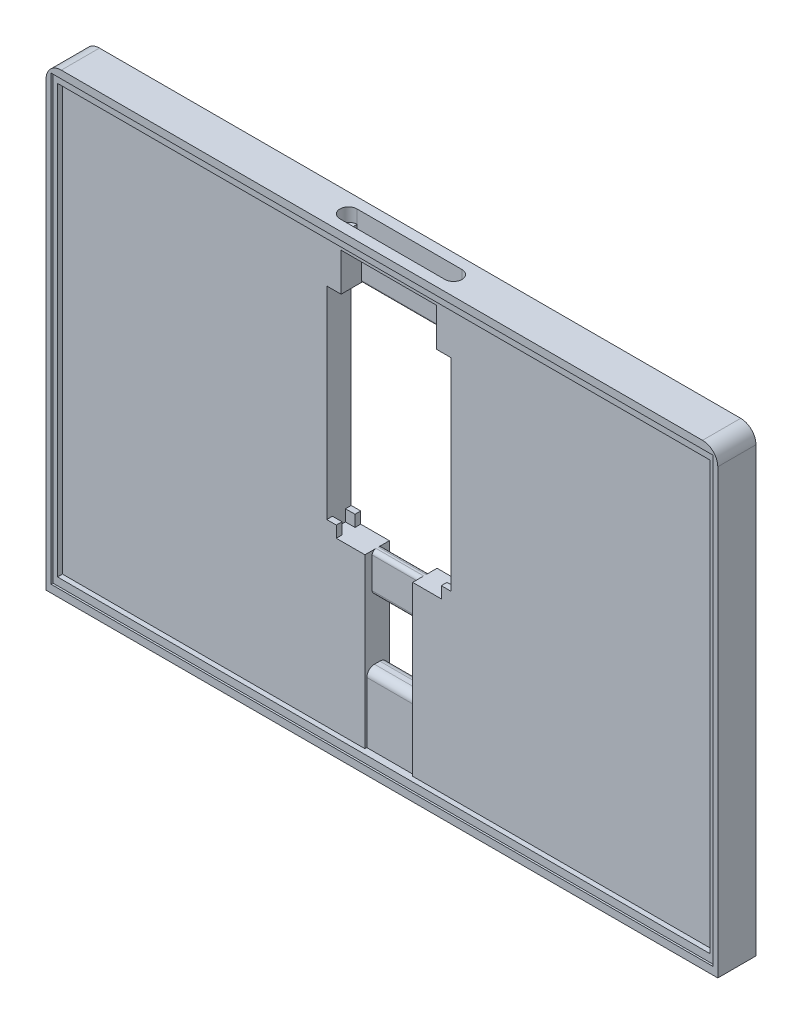
from build123d import *

# Parameters (mm, degrees)
SKETCH_1_W           = 176
SKETCH_1_H           = 120
EXTRUDE_1_DEPTH      = 10
SKETCH_2_W           = 171
SKETCH_2_H           = 112
CUT_EXTRUDE_1_DEPTH  = 1.8
SKETCH_3_W           = 171
SKETCH_3_H           = 112
CUT_EXTRUDE_2_DEPTH  = 1.8
SKETCH_5_W           = 173.4
SKETCH_5_H           = 116
CUT_EXTRUDE_3_DEPTH  = 0.5
SKETCH_6_W           = 173.4
SKETCH_6_H           = 116
CUT_EXTRUDE_4_DEPTH  = 0.5
SKETCH_7_W           = 32.5
SKETCH_7_H           = 56
CUT_EXTRUDE_5_DEPTH  = 107.823405675
SKETCH_8_W           = 12.5
SKETCH_8_H           = 44
CUT_EXTRUDE_6_DEPTH  = 0.5
SKETCH_9_W           = 12.5
SKETCH_9_H           = 44
CUT_EXTRUDE_7_DEPTH  = 0.5
SKETCH_10_W          = 25
SKETCH_10_H          = 12
CUT_EXTRUDE_8_DEPTH  = 0.8
CUT_EXTRUDE_10_DEPTH = 6
FILLET_1_R           = 4
FILLET_2_R           = 4
SKETCH_18_W          = 1.5
SKETCH_18_H          = 3
EXTRUDE_3_DEPTH      = 2.5
SKETCH_20_W          = 1.5
SKETCH_20_H          = 3
EXTRUDE_4_DEPTH      = 2.5
SKETCH_21_W          = 12.5
SKETCH_21_H          = 16
CUT_EXTRUDE_12_DEPTH = 107.786188245
SKETCH_22_W          = 25
SKETCH_22_H          = 10
CUT_EXTRUDE_13_DEPTH = 4.5
SKETCH_23_W          = 25
SKETCH_23_H          = 2
EXTRUDE_5_DEPTH      = 0.8
FILLET_15_R          = 0.5
EXTRUDE_START        = 2.5
EXTRUDE_6_DEPTH      = 2.5
SKETCH_25_W          = 12.5
SKETCH_25_H          = 10.082968054
CUT_EXTRUDE_14_DEPTH = 1.4
SKETCH_26_W          = 12.5
SKETCH_26_H          = 10.082968054
CUT_EXTRUDE_15_DEPTH = 1.4
FILLET_16_R          = 1
FILLET_17_R          = 1
FILLET_18_R          = 1
FILLET_19_R          = 1
FILLET_21_R          = 2
FILLET_22_R          = 2
SKETCH_28_R          = 2.75
CUT_EXTRUDE_16_DEPTH = 5.5
FILLET_23_R          = 0.5


with BuildPart() as part:
    # 草图1 → 凸台-拉伸1 (new body)
    with BuildSketch(Plane.XY):
        Rectangle(SKETCH_1_W, SKETCH_1_H)
    extrude(amount=EXTRUDE_1_DEPTH)

    # 草图2 → 切除-拉伸1 (cut)
    with BuildSketch(Plane.XY.offset(10)):
        Rectangle(SKETCH_2_W, SKETCH_2_H)
    extrude(amount=-CUT_EXTRUDE_1_DEPTH, mode=Mode.SUBTRACT)

    # 草图3 → 切除-拉伸2 (cut)
    with BuildSketch(Plane(origin=(0, 0, 0), x_dir=(-1, 0, 0), z_dir=(0, 0, -1))):
        Rectangle(SKETCH_3_W, SKETCH_3_H)
    extrude(amount=-CUT_EXTRUDE_2_DEPTH, mode=Mode.SUBTRACT)

    # 草图5 → 切除-拉伸3 (cut)
    with BuildSketch(Plane(origin=(0, 0, 0), x_dir=(-1, 0, 0), z_dir=(0, 0, -1))):
        Rectangle(SKETCH_5_W, SKETCH_5_H)
    extrude(amount=-CUT_EXTRUDE_3_DEPTH, mode=Mode.SUBTRACT)

    # 草图6 → 切除-拉伸4 (cut)
    with BuildSketch(Plane.XY.offset(10)):
        Rectangle(SKETCH_6_W, SKETCH_6_H)
    extrude(amount=-CUT_EXTRUDE_4_DEPTH, mode=Mode.SUBTRACT)

    # 草图7 → 切除-拉伸5 (cut, through all)
    with BuildSketch(Plane(origin=(0, 0, 1.8), x_dir=(-1, 0, 0), z_dir=(0, 0, -1))):
        with Locations((0, 16)):
            Rectangle(SKETCH_7_W, SKETCH_7_H)
    extrude(amount=-CUT_EXTRUDE_5_DEPTH, mode=Mode.SUBTRACT)

    # 草图8 → 切除-拉伸6 (cut)
    with BuildSketch(Plane(origin=(0, 0, 1.8), x_dir=(-1, 0, 0), z_dir=(0, 0, -1))):
        with Locations((0, -34)):
            Rectangle(SKETCH_8_W, SKETCH_8_H)
    extrude(amount=-CUT_EXTRUDE_6_DEPTH, mode=Mode.SUBTRACT)

    # 草图9 → 切除-拉伸7 (cut)
    with BuildSketch(Plane.XY.offset(8.2)):
        with Locations((0, -34)):
            Rectangle(SKETCH_9_W, SKETCH_9_H)
    extrude(amount=-CUT_EXTRUDE_7_DEPTH, mode=Mode.SUBTRACT)

    # 草图10 → 切除-拉伸8 (cut)
    with BuildSketch(Plane.XY.offset(8.2)):
        with Locations((0, 50)):
            Rectangle(SKETCH_10_W, SKETCH_10_H)
    extrude(amount=-CUT_EXTRUDE_8_DEPTH, mode=Mode.SUBTRACT)

    # 草图13 → 切除-拉伸10 (cut)
    with BuildSketch(Plane(origin=(0, 60, 0), x_dir=(1, 0, 0), z_dir=(0, 1, 0))):
        with BuildLine():
            Line((-13.75, -2.75), (13.75, -2.75))
            ThreePointArc((13.75, -2.75), (16, -5), (13.75, -7.25))
            Line((13.75, -7.25), (-13.75, -7.25))
            ThreePointArc((-13.75, -7.25), (-16, -5), (-13.75, -2.75))
        make_face()
    extrude(amount=-CUT_EXTRUDE_10_DEPTH, mode=Mode.SUBTRACT)

    # 圆角1
    fillet_1_edges = [part.edges().sort_by_distance(p)[0] for p in [
        (-88, 60, 5),
    ]]
    fillet(fillet_1_edges, radius=FILLET_1_R)

    # 圆角2
    fillet_2_edges = [part.edges().sort_by_distance(p)[0] for p in [
        (88, 60, 5),
    ]]
    fillet(fillet_2_edges, radius=FILLET_2_R)

    # 草图18 → 凸台-拉伸3 (add)
    with BuildSketch(Plane(origin=(-16.25, 0, 0), x_dir=(0, 0, -1), z_dir=(1, 0, 0))):
        with Locations((-2.55, -10.5)):
            Rectangle(SKETCH_18_W, SKETCH_18_H)
        with Locations((-7.45, -10.5)):
            Rectangle(SKETCH_18_W, SKETCH_18_H)
    extrude(amount=EXTRUDE_3_DEPTH)

    # 草图20 → 凸台-拉伸4 (add)
    with BuildSketch(Plane.ZY.offset(-16.25)):
        with Locations((7.45, -10.5)):
            Rectangle(SKETCH_20_W, SKETCH_20_H)
        with Locations((2.55, -10.5)):
            Rectangle(SKETCH_20_W, SKETCH_20_H)
    extrude(amount=EXTRUDE_4_DEPTH)

    # 草图21 → 切除-拉伸12 (cut, through all)
    with BuildSketch(Plane(origin=(0, 0, 2.3), x_dir=(-1, 0, 0), z_dir=(0, 0, -1))):
        with Locations((0, -30.082968054)):
            Rectangle(SKETCH_21_W, SKETCH_21_H)
    extrude(amount=-CUT_EXTRUDE_12_DEPTH, mode=Mode.SUBTRACT)

    # 草图22 → 切除-拉伸13 (cut)
    with BuildSketch(Plane.XY.offset(7.4)):
        with Locations((0, 49)):
            Rectangle(SKETCH_22_W, SKETCH_22_H)
    extrude(amount=-CUT_EXTRUDE_13_DEPTH, mode=Mode.SUBTRACT)

    # 草图23 → 凸台-拉伸5 (add)
    with BuildSketch(Plane.XY.offset(7.4)):
        with Locations((0, 55)):
            Rectangle(SKETCH_23_W, SKETCH_23_H)
    extrude(amount=EXTRUDE_5_DEPTH)

    # 圆角15
    fillet_15_edges = [part.edges().sort_by_distance(p)[0] for p in [
        (0, 54, 7.25),
    ]]
    fillet(fillet_15_edges, radius=FILLET_15_R)

    # 草图24 → 凸台-拉伸6 (add)
    with BuildSketch(Plane(origin=(0, 54, 0), x_dir=(1, 0, 0), z_dir=(0, 1, 0)).offset(EXTRUDE_START)):
        with BuildLine():
            Line((-13.75, -2.75), (-13.75, -7.25))
            ThreePointArc((-13.75, -7.25), (-16, -5), (-13.75, -2.75))
        make_face()
        with BuildLine():
            Line((13.75, -2.75), (13.75, -7.25))
            ThreePointArc((13.75, -7.25), (16, -5), (13.75, -2.75))
        make_face()
    extrude(amount=-EXTRUDE_6_DEPTH)

    # 草图25 → 切除-拉伸14 (cut)
    with BuildSketch(Plane.XY.offset(7.7)):
        with Locations((0, -17.041484027)):
            Rectangle(SKETCH_25_W, SKETCH_25_H)
    extrude(amount=-CUT_EXTRUDE_14_DEPTH, mode=Mode.SUBTRACT)

    # 草图26 → 切除-拉伸15 (cut)
    with BuildSketch(Plane(origin=(0, 0, 2.3), x_dir=(-1, 0, 0), z_dir=(0, 0, -1))):
        with Locations((0, -17.041484027)):
            Rectangle(SKETCH_26_W, SKETCH_26_H)
    extrude(amount=-CUT_EXTRUDE_15_DEPTH, mode=Mode.SUBTRACT)

    # 圆角16
    fillet_16_edges = [part.edges().sort_by_distance(p)[0] for p in [
        (0, -22.082968054, 3.7),
    ]]
    fillet(fillet_16_edges, radius=FILLET_16_R)

    # 圆角17
    fillet_17_edges = [part.edges().sort_by_distance(p)[0] for p in [
        (0, -12, 3.7),
    ]]
    fillet(fillet_17_edges, radius=FILLET_17_R)

    # 圆角18
    fillet_18_edges = [part.edges().sort_by_distance(p)[0] for p in [
        (0, -12, 6.3),
    ]]
    fillet(fillet_18_edges, radius=FILLET_18_R)

    # 圆角19
    fillet_19_edges = [part.edges().sort_by_distance(p)[0] for p in [
        (0, -22.082968054, 6.3),
    ]]
    fillet(fillet_19_edges, radius=FILLET_19_R)

    # 圆角21
    fillet_21_edges = [part.edges().sort_by_distance(p)[0] for p in [
        (0, -38.082968054, 7.7),
    ]]
    fillet(fillet_21_edges, radius=FILLET_21_R)

    # 圆角22
    fillet_22_edges = [part.edges().sort_by_distance(p)[0] for p in [
        (0, -38.082968054, 2.3),
    ]]
    fillet(fillet_22_edges, radius=FILLET_22_R)

    # 草图28 → 切除-拉伸16 (cut)
    with BuildSketch(Plane(origin=(0, -60, 0), x_dir=(-1, 0, 0), z_dir=(0, -1, 0))):
        with Locations(Location((-72, -5, 0), (0, 0, 180))):
            Circle(SKETCH_28_R)
        with Locations(Location((-38, -5, 0), (0, 0, 180))):
            Circle(SKETCH_28_R)
        with Locations(Location((38, -5, 0), (0, 0, 180))):
            Circle(SKETCH_28_R)
        with Locations(Location((72, -5, 0), (0, 0, 180))):
            Circle(SKETCH_28_R)
    extrude(amount=-CUT_EXTRUDE_16_DEPTH, mode=Mode.SUBTRACT)

    # 圆角23
    fillet_23_edges = [part.edges().sort_by_distance(p)[0] for p in [
        (0, 44, 2.9),
    ]]
    fillet(fillet_23_edges, radius=FILLET_23_R)


solid = part.part
